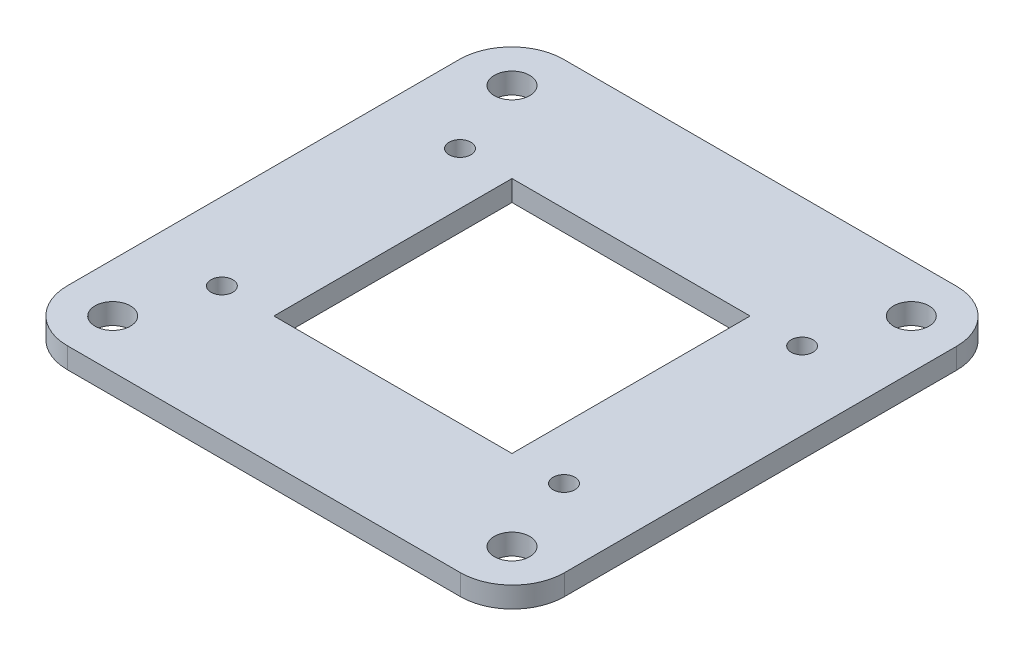
from build123d import *

# Parameters (mm, degrees)
SKETCH_1_R      = 1.7
SKETCH_1_R_2    = 1.05
SKETCH_1_W      = 22.9
SKETCH_1_H      = 22.9
EXTRUDE_1_DEPTH = 2


with BuildPart() as part:
    # 草图1 → 凸台-拉伸1 (new body)
    with BuildSketch(Plane(origin=(0, 0, 0), x_dir=(1, 0, 0), z_dir=(0, 1, 0))):
        with BuildLine():
            ThreePointArc((-23.9, -18.856654127), (-22.435533906, -22.392188032), (-18.9, -23.856654127))
            Line((-18.9, -23.856654127), (18.9, -23.856654127))
            ThreePointArc((18.9, -23.856654127), (22.435533906, -22.392188032), (23.9, -18.856654127))
            Line((23.9, -18.856654127), (23.9, -0.043345873))
            Line((23.9, -0.043345873), (23.9, 0.043345873))
            Line((23.9, 0.043345873), (23.9, 18.856654127))
            ThreePointArc((23.9, 18.856654127), (22.435533906, 22.392188032), (18.9, 23.856654127))
            Line((18.9, 23.856654127), (-18.9, 23.856654127))
            ThreePointArc((-18.9, 23.856654127), (-22.435533906, 22.392188032), (-23.9, 18.856654127))
            Line((-23.9, 18.856654127), (-23.9, 0.043345873))
            Line((-23.9, 0.043345873), (-23.9, -0.043345873))
            Line((-23.9, -0.043345873), (-23.9, -18.856654127))
        make_face()
        with Locations(Location((-19.2, -19.2, 0), (0, 0, 270))):
            Circle(SKETCH_1_R, mode=Mode.SUBTRACT)
        with Locations(Location((-16.45, -11.45, 0), (0, 0, 270))):
            Circle(SKETCH_1_R_2, mode=Mode.SUBTRACT)
        with Locations(Location((19.2, -19.2, 0), (0, 0, 270))):
            Circle(SKETCH_1_R, mode=Mode.SUBTRACT)
        Rectangle(SKETCH_1_W, SKETCH_1_H, mode=Mode.SUBTRACT)
        with Locations(Location((16.45, -11.45, 0), (0, 0, 270))):
            Circle(SKETCH_1_R_2, mode=Mode.SUBTRACT)
        with Locations(Location((-16.45, 11.45, 0), (0, 0, 270))):
            Circle(SKETCH_1_R_2, mode=Mode.SUBTRACT)
        with Locations(Location((-19.2, 19.2, 0), (0, 0, 270))):
            Circle(SKETCH_1_R, mode=Mode.SUBTRACT)
        with Locations(Location((16.45, 11.45, 0), (0, 0, 270))):
            Circle(SKETCH_1_R_2, mode=Mode.SUBTRACT)
        with Locations(Location((19.2, 19.2, 0), (0, 0, 270))):
            Circle(SKETCH_1_R, mode=Mode.SUBTRACT)
    extrude(amount=EXTRUDE_1_DEPTH)


solid = part.part
